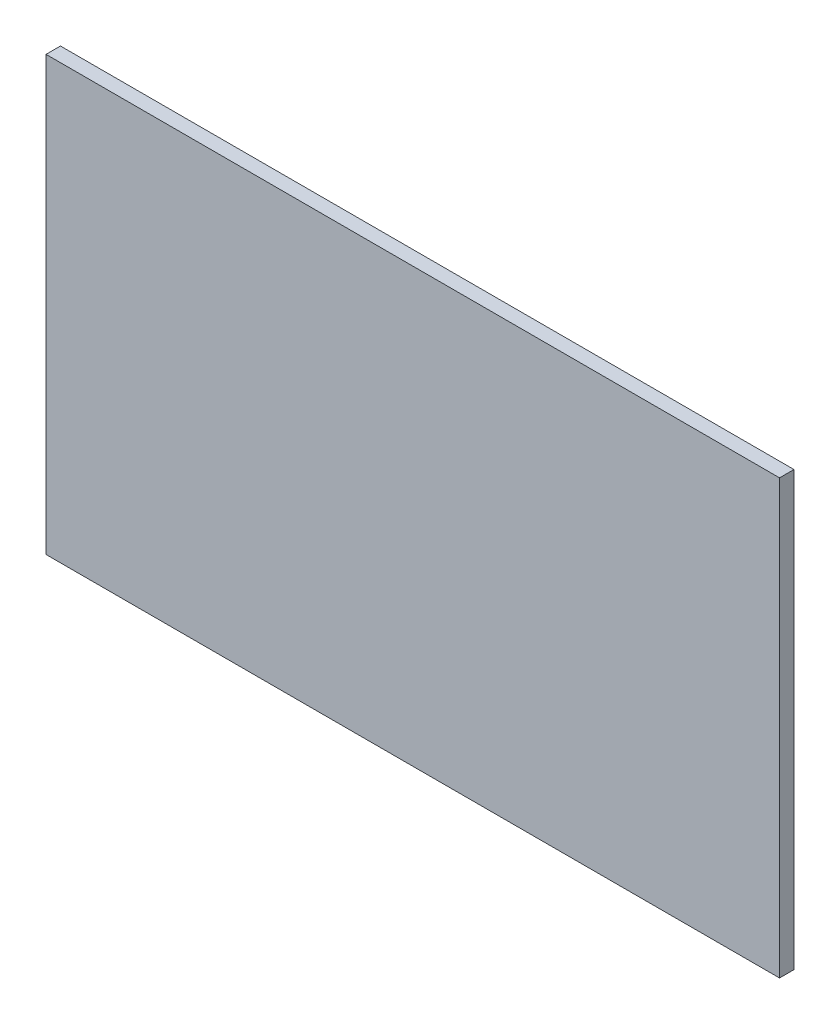
from build123d import *

# Parameters (mm, degrees)
SKETCH1_W           = 50.8
SKETCH1_H           = 30
BOSS_EXTRUDE1_DEPTH = 1


with BuildPart() as part:
    # Sketch1 → Boss-Extrude1 (new body)
    with BuildSketch(Plane.XY):
        Rectangle(SKETCH1_W, SKETCH1_H)
    extrude(amount=BOSS_EXTRUDE1_DEPTH)


solid = part.part
